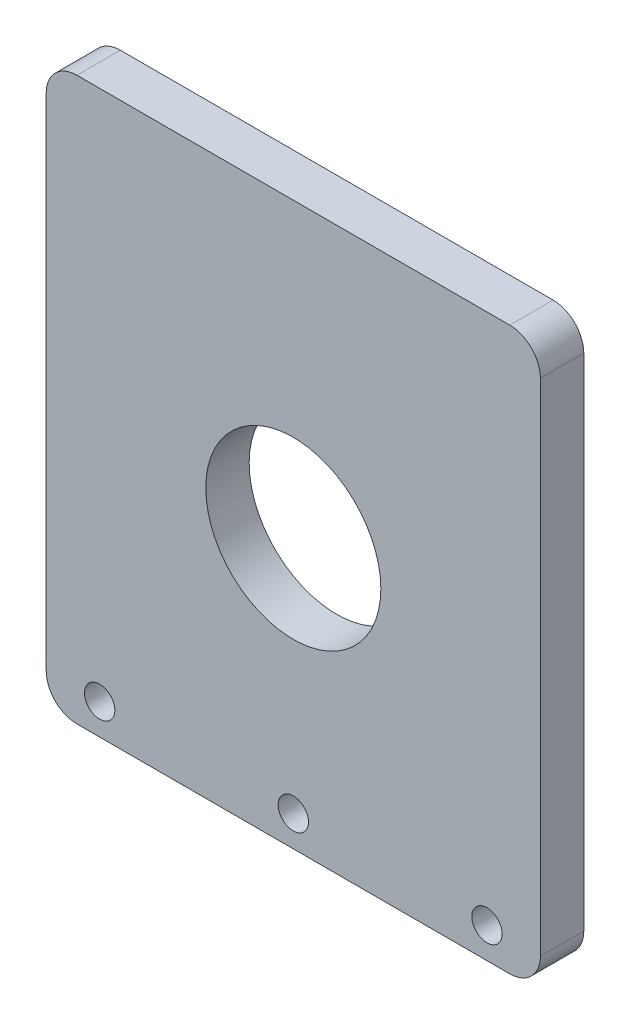
from build123d import *

# Parameters (mm, degrees)
SKETCH1_R           = 2.4892
SKETCH1_R_2         = 14.351
BOSS_EXTRUDE1_DEPTH = 7.112


with BuildPart() as part:
    # Sketch1 → Boss-Extrude1 (new body)
    with BuildSketch(Plane.XY):
        with BuildLine():
            Line((-4581.597292992, 2459.273178096), (-4581.597292992, 2377.220406358))
            ThreePointArc((-4581.597292992, 2377.220406358), (-4583.070311568, 2373.664224934), (-4586.626492992, 2372.191206358))
            Line((-4586.626492992, 2372.191206358), (-4657.594092992, 2372.191206358))
            ThreePointArc((-4657.594092992, 2372.191206358), (-4661.150274416, 2373.664224934), (-4662.623292992, 2377.220406358))
            Line((-4662.623292992, 2377.220406358), (-4662.623292992, 2459.273178096))
            ThreePointArc((-4662.623292992, 2459.273178096), (-4661.150274416, 2462.82935952), (-4657.594092992, 2464.302378096))
            Line((-4657.594092992, 2464.302378096), (-4586.626492992, 2464.302378096))
            ThreePointArc((-4586.626492992, 2464.302378096), (-4583.070311568, 2462.82935952), (-4581.597292992, 2459.273178096))
        make_face()
        with Locations((-4653.860292992, 2377.220406358)):
            Circle(SKETCH1_R, mode=Mode.SUBTRACT)
        with Locations((-4590.360292992, 2377.220406358)):
            Circle(SKETCH1_R, mode=Mode.SUBTRACT)
        with Locations((-4622.110292992, 2416.285606358)):
            Circle(SKETCH1_R_2, mode=Mode.SUBTRACT)
        with Locations((-4622.110292992, 2377.220406358)):
            Circle(SKETCH1_R, mode=Mode.SUBTRACT)
    extrude(amount=BOSS_EXTRUDE1_DEPTH)


solid = part.part
